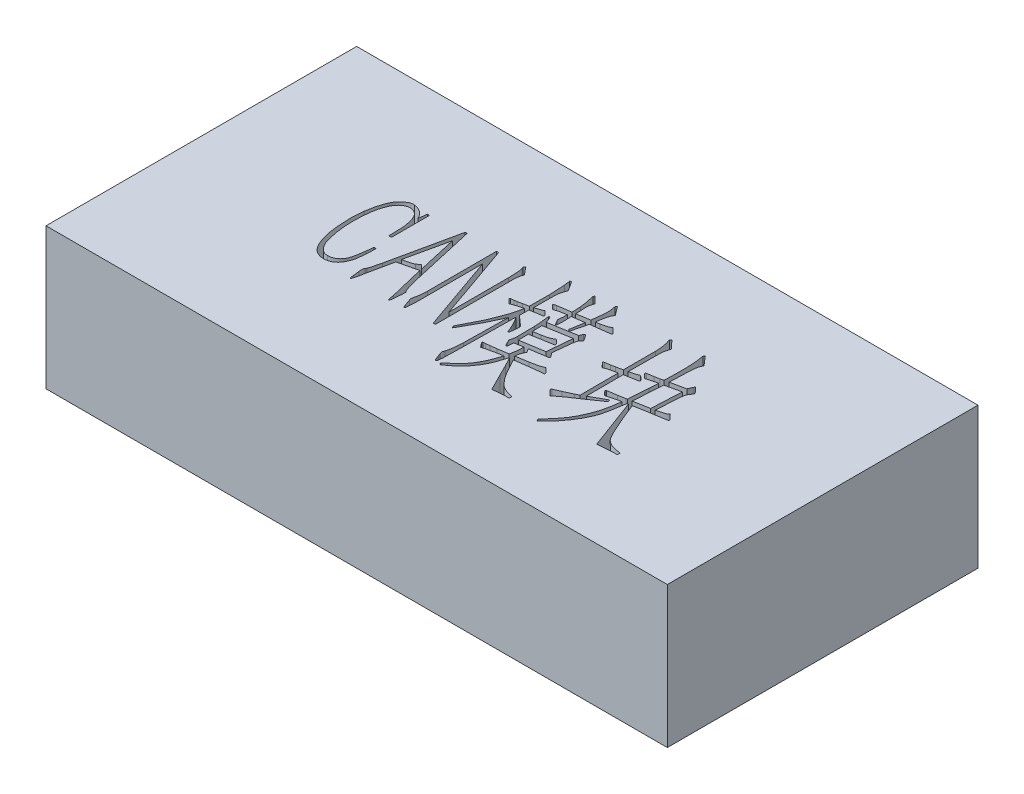
from build123d import *

# Parameters (mm, degrees)
SKETCH_1_W          = 22
SKETCH_1_H          = 11
EXTRUDE_1_DEPTH     = 5
CUT_EXTRUDE_1_DEPTH = 2


with BuildPart() as part:
    # 草图1 → 凸台-拉伸1 (new body)
    with BuildSketch(Plane(origin=(0, 0, 0), x_dir=(1, 0, 0), z_dir=(0, 1, 0))):
        Rectangle(SKETCH_1_W, SKETCH_1_H)
    extrude(amount=EXTRUDE_1_DEPTH)

    # 草图2 → 切除-拉伸1 (cut)
    # profile 1 of 8: a face of its own
    with BuildSketch(Plane(origin=(0, 5, 0), x_dir=(1, 0, 0), z_dir=(0, 1, 0))):
        with BuildLine():
            Line((-4.64088319, 1.310616693), (-4.605085193, 1.607441751))
            Line((-4.605085193, 1.607441751), (-4.529760241, 1.607441751))
            Line((-4.529760241, 1.607441751), (-4.529760241, 0.26352528))
            Line((-4.529760241, 0.26352528), (-4.625221566, 0.26352528))
            add(Edge.make_bspline(
                [(-4.625221566, 0.26352528), (-4.625352176, 0.287890137), (-4.625625439, 0.338866508), (-4.628541794, 0.420381785), (-4.630403387, 0.513374425), (-4.633571719, 0.618277741), (-4.636548971, 0.730597951), (-4.647539021, 0.845609071), (-4.664340131, 0.961845619), (-4.689979792, 1.078438421), (-4.723696551, 1.190871874), (-4.763534204, 1.27644821), (-4.800730949, 1.336535501), (-4.831200971, 1.375596691), (-4.865164463, 1.408878602), (-4.913767137, 1.445089925), (-4.980147624, 1.481572074), (-5.038889885, 1.491905022), (-5.068221779, 1.497064594)],
                knots=[0, 0, 0, 0, 0.822473136, 1.720785642, 2.753326599, 3.962261781, 5.264018637, 6.545024146, 7.860049611, 9.226346671, 10.572050264, 11.814683136, 12.399128484, 12.954850798, 13.483022901, 13.998303406, 15.000488703, 16, 16, 16, 16], degree=3))
            add(Edge.make_bspline(
                [(-5.068221779, 1.497064594), (-5.09064734, 1.497662838), (-5.135404141, 1.49885681), (-5.201946005, 1.485400853), (-5.266047028, 1.460286798), (-5.327546285, 1.42389627), (-5.386131353, 1.377130173), (-5.438090626, 1.317303176), (-5.4874979, 1.248621381), (-5.528474857, 1.168198102), (-5.564786533, 1.081764951), (-5.598564105, 0.99183706), (-5.62476189, 0.898110911), (-5.653099724, 0.770767415), (-5.678296215, 0.612791216), (-5.696399107, 0.428897936), (-5.705861374, 0.257175421), (-5.709191424, 0.096965535), (-5.705902254, -0.057002939), (-5.700437167, -0.158605462), (-5.697669893, -0.210052389)],
                knots=[0, 0, 0, 0, 0.603095173, 1.203653813, 1.814626149, 2.451293107, 3.123130818, 3.825388984, 4.580186105, 5.398460658, 6.251023789, 7.107448911, 7.985514538, 8.871470416, 10.622993602, 12.29317529, 13.850163291, 15.257553743, 16.61134915, 18, 18, 18, 18], degree=3))
            add(Edge.make_bspline(
                [(-5.697669893, -0.210052389), (-5.693646193, -0.256060744), (-5.685412829, -0.350203831), (-5.6717096, -0.469630663), (-5.655865374, -0.570725765), (-5.640155543, -0.654033399), (-5.620573195, -0.744255216), (-5.598601647, -0.837924557), (-5.57387269, -0.927538825), (-5.550653592, -1.007006365), (-5.527248928, -1.071905906), (-5.496453113, -1.138896515), (-5.452881369, -1.209201925), (-5.396278341, -1.284977893), (-5.332806056, -1.34767257), (-5.264757225, -1.395395436), (-5.18883468, -1.423134335), (-5.135817529, -1.426299087), (-5.108494526, -1.427930079)],
                knots=[0, 0, 0, 0, 1.515526627, 3.101096572, 3.943353373, 4.87293365, 5.882541642, 6.972773351, 8.029529644, 8.932786276, 9.68898916, 10.291221641, 11.348890653, 12.39638072, 13.388602443, 14.264213047, 15.105442077, 16, 16, 16, 16], degree=3))
            add(Edge.make_bspline(
                [(-5.108494526, -1.427930079), (-5.083031737, -1.428273572), (-5.031179152, -1.428973064), (-4.953948301, -1.409331756), (-4.878978017, -1.377956202), (-4.80895065, -1.331628839), (-4.747164525, -1.270124982), (-4.694617135, -1.19359554), (-4.652946882, -1.102448826), (-4.624152757, -0.99832507), (-4.600922084, -0.885987529), (-4.585821128, -0.790123386), (-4.575135352, -0.717668868), (-4.568221257, -0.674230019), (-4.563885509, -0.641856133), (-4.561341319, -0.624214003), (-4.560337697, -0.617254605)],
                knots=[0, 0, 0, 0, 0.974493461, 1.984464659, 3.032762083, 4.086915356, 5.187622472, 6.361151533, 7.634420725, 9.018373663, 10.501751059, 12.040324543, 12.745324753, 13.31527632, 13.729892907, 14, 14, 14, 14], degree=3))
            Line((-4.560337697, -0.617254605), (-4.534980782, -0.351007002))
            Line((-4.534980782, -0.351007002), (-4.454435289, -0.355481752))
            add(Edge.make_bspline(
                [(-4.454435289, -0.355481752), (-4.454334893, -0.380342441), (-4.454152168, -0.425590412), (-4.455262727, -0.487235193), (-4.455480292, -0.536231794), (-4.457478083, -0.576233602), (-4.458774778, -0.613809502), (-4.462039855, -0.655817693), (-4.466463653, -0.705793636), (-4.474431522, -0.779553017), (-4.482453234, -0.867955352), (-4.493678778, -0.966918593), (-4.510390695, -1.06361388), (-4.541749595, -1.164541573), (-4.584919978, -1.270493074), (-4.633681408, -1.355033718), (-4.680162645, -1.417582114), (-4.72084246, -1.459254445), (-4.765982353, -1.497273329), (-4.816291524, -1.529401076), (-4.86938156, -1.556413497), (-4.92469472, -1.575577703), (-4.980775236, -1.589972515), (-5.019161583, -1.592816829), (-5.038390115, -1.594241607)],
                knots=[0, 0, 0, 0, 1.082557886, 1.97032136, 2.684891572, 3.215786613, 3.714233695, 4.322010655, 5.050226996, 5.899051791, 7.552532718, 8.915438272, 10.236158893, 11.818471953, 13.507262255, 15.209909354, 16.052150521, 16.894322113, 17.739826851, 18.616631911, 19.488074199, 20.326969254, 21.161943562, 22, 22, 22, 22], degree=3))
            add(Edge.make_bspline(
                [(-5.038390115, -1.594241607), (-5.070554956, -1.595650565), (-5.136069877, -1.5985204), (-5.232714607, -1.576484069), (-5.323112626, -1.541568865), (-5.391944611, -1.501413288), (-5.441045015, -1.461581303), (-5.476056004, -1.424939523), (-5.51143879, -1.383199835), (-5.545317499, -1.334464722), (-5.579200792, -1.2799696), (-5.610766721, -1.218886753), (-5.64134625, -1.15208205), (-5.6822839, -1.053472378), (-5.72642208, -0.916929581), (-5.761630997, -0.771212133), (-5.785310664, -0.645196031), (-5.799563665, -0.542303896), (-5.813288107, -0.433461512), (-5.827816331, -0.281875359), (-5.839788932, -0.09340554), (-5.845909357, 0.129269821), (-5.839459768, 0.349907173), (-5.822100092, 0.496305055), (-5.813267592, 0.570791421)],
                knots=[0, 0, 0, 0, 0.828879423, 1.68830212, 2.536676829, 3.328986324, 3.73541648, 4.167069034, 4.63682846, 5.148487351, 5.699502401, 6.294435402, 6.924061178, 7.598240742, 9.053084533, 10.627089957, 11.470192478, 12.366164513, 13.311378798, 14.305576584, 16.301598498, 18.191207909, 20.062109376, 22, 22, 22, 22], degree=3))
            add(Edge.make_bspline(
                [(-5.813267592, 0.570791421), (-5.80318928, 0.645361694), (-5.783131982, 0.793767314), (-5.738376553, 0.973809487), (-5.695775042, 1.109293065), (-5.662673144, 1.199636964), (-5.627523804, 1.278239068), (-5.591488667, 1.346761189), (-5.552798896, 1.406440123), (-5.51212122, 1.460042103), (-5.466698773, 1.506091321), (-5.420472593, 1.54695334), (-5.374053898, 1.580297808), (-5.331391303, 1.607963118), (-5.293816024, 1.630313019), (-5.247160801, 1.649818792), (-5.185726889, 1.664836825), (-5.135190897, 1.663393034), (-5.108494526, 1.66263033)],
                knots=[0, 0, 0, 0, 2.546659555, 5.068220541, 6.268960188, 7.35572531, 8.324149365, 9.182807276, 9.974388089, 10.730435642, 11.456747585, 12.160764052, 12.817438768, 13.389505863, 13.883390408, 14.294592413, 15.099093679, 16, 16, 16, 16], degree=3))
            add(Edge.make_bspline(
                [(-5.108494526, 1.66263033), (-5.081195696, 1.657955707), (-5.025245096, 1.648374785), (-4.943426183, 1.618358543), (-4.862623703, 1.576915203), (-4.792683591, 1.518407564), (-4.730821085, 1.457958676), (-4.699931445, 1.412300315), (-4.685630686, 1.391162186)],
                knots=[0, 0, 0, 0, 0.959137923, 1.965811105, 3.01152559, 4.09188384, 5.116612916, 6, 6, 6, 6], degree=3))
            Line((-4.685630686, 1.391162186), (-4.64088319, 1.310616693))
        make_face()
    # profile 2 of 8: a face of its own
    with BuildSketch(Plane(origin=(0, 5, 0), x_dir=(1, 0, 0), z_dir=(0, 1, 0))):
        with BuildLine():
            Line((-3.012820117, -0.250325135), (-3.69745681, -0.415890872))
            Line((-3.69745681, -0.415890872), (-3.858547797, -1.166157226))
            Line((-3.858547797, -1.166157226), (-3.93461854, -1.548748319))
            Line((-3.93461854, -1.548748319), (-3.964450205, -1.669566559))
            add(Edge.make_bspline(
                [(-3.964450205, -1.669566559), (-3.967617933, -1.678124642), (-3.972960011, -1.69255705), (-3.983011742, -1.709536927), (-3.994042244, -1.717975047), (-4.006357923, -1.719753837), (-4.015597329, -1.709074642), (-4.021091501, -1.695540678), (-4.022736015, -1.675679395), (-4.027305697, -1.649820743), (-4.030163449, -1.612829118), (-4.033442582, -1.584777574), (-4.035300407, -1.568884692)],
                knots=[0, 0, 0, 0, 1.226577759, 2.068508672, 2.595953142, 3.064162245, 3.560072257, 4.322224954, 5.029865969, 6.20926766, 7.852322798, 10, 10, 10, 10], degree=3))
            Line((-4.035300407, -1.568884692), (-4.05991153, -1.357825668))
            add(Edge.make_bspline(
                [(-4.05991153, -1.357825668), (-4.061502368, -1.340433492), (-4.064340436, -1.309405719), (-4.066834096, -1.268354603), (-4.066996006, -1.238736671), (-4.065560792, -1.213958485), (-4.058223447, -1.190526359), (-4.04950673, -1.174467781), (-4.044995698, -1.166157226)],
                knots=[0, 0, 0, 0, 1.603576797, 2.86079302, 3.773774944, 4.323462854, 5.1323669, 6, 6, 6, 6], degree=3))
            Line((-4.044995698, -1.166157226), (-4.019638783, -1.120663938))
            add(Edge.make_bspline(
                [(-4.019638783, -1.120663938), (-4.014208014, -1.108815091), (-4.001238171, -1.080517501), (-3.984815897, -1.028423229), (-3.967319722, -0.960595675), (-3.94968981, -0.882527364), (-3.93240851, -0.806924943), (-3.918602835, -0.745323182), (-3.908006694, -0.704461353), (-3.901115312, -0.684357971), (-3.898820543, -0.677663725)],
                knots=[0, 0, 0, 0, 0.679694972, 1.623257572, 2.844174753, 4.335796169, 5.799225578, 6.891200865, 7.630779852, 8, 8, 8, 8], degree=3))
            Line((-3.898820543, -0.677663725), (-3.380495378, 1.72303945))
            Line((-3.380495378, 1.72303945), (-3.310390967, 1.72303945))
            Line((-3.310390967, 1.72303945), (-2.821897466, -0.436027245))
            Line((-2.821897466, -0.436027245), (-2.761488346, -0.688104807))
            add(Edge.make_bspline(
                [(-2.761488346, -0.688104807), (-2.755428749, -0.716481156), (-2.744558718, -0.767384169), (-2.72801762, -0.834985596), (-2.714451659, -0.885609177), (-2.704912545, -0.913366423), (-2.701079227, -0.924520746)],
                knots=[0, 0, 0, 0, 1.425899692, 2.557855139, 3.420470246, 4, 4, 4, 4], degree=3))
            Line((-2.701079227, -0.924520746), (-2.666027021, -1.019982071))
            add(Edge.make_bspline(
                [(-2.666027021, -1.019982071), (-2.661992255, -1.033965784), (-2.654641068, -1.059443568), (-2.642083726, -1.093163092), (-2.629742677, -1.119199179), (-2.614029465, -1.141126967), (-2.598090769, -1.157584597), (-2.587089035, -1.174651918), (-2.585699152, -1.19058476), (-2.587626217, -1.205191231), (-2.589684158, -1.223794305), (-2.590685502, -1.247218507), (-2.593343785, -1.279491719), (-2.594518059, -1.303874415), (-2.595176819, -1.317552921)],
                knots=[0, 0, 0, 0, 1.645080438, 2.997272953, 4.065812928, 4.892545225, 6.029861332, 6.67147811, 7.124734071, 7.80170629, 8.338742145, 9.240009017, 10.451666043, 12, 12, 12, 12], degree=3))
            Line((-2.595176819, -1.317552921), (-2.615313192, -1.543527778))
            Line((-2.615313192, -1.543527778), (-2.625754274, -1.629293812))
            add(Edge.make_bspline(
                [(-2.625754274, -1.629293812), (-2.626250698, -1.639020218), (-2.627133113, -1.656309334), (-2.63138714, -1.678579787), (-2.634172266, -1.694745403), (-2.640039875, -1.706440704), (-2.651187815, -1.712223664), (-2.665008131, -1.708190065), (-2.675630255, -1.694211167), (-2.678986139, -1.681941292), (-2.680942853, -1.6747871)],
                knots=[0, 0, 0, 0, 1.663187075, 2.956388731, 3.874273883, 4.464983498, 5.130530035, 5.83179128, 6.735783313, 8, 8, 8, 8], degree=3))
            Line((-2.680942853, -1.6747871), (-2.715995059, -1.473423367))
            Line((-2.715995059, -1.473423367), (-3.012820117, -0.250325135))
        make_face()
        with BuildLine():
            Line((-3.0232612, -0.174254392), (-3.345443173, 1.23976649))
            Line((-3.345443173, 1.23976649), (-3.672845687, -0.239884053))
            add(Edge.make_bspline(
                [(-3.672845687, -0.239884053), (-3.644443709, -0.235506257), (-3.595410409, -0.227948412), (-3.527068804, -0.212938639), (-3.462387965, -0.195171738), (-3.404950954, -0.179279335), (-3.357507121, -0.163156776), (-3.326508064, -0.152488665), (-3.30295788, -0.141465552), (-3.290431738, -0.133108195), (-3.285034053, -0.129506895)],
                knots=[0, 0, 0, 0, 1.70172219, 2.937860729, 4.141475294, 5.674569601, 6.46612829, 7.108957565, 7.616037637, 8, 8, 8, 8], degree=3))
            Line((-3.285034053, -0.129506895), (-3.158995272, -0.043740861))
            Line((-3.158995272, -0.043740861), (-3.0232612, -0.174254392))
        make_face(mode=Mode.SUBTRACT)
    # profile 3 of 8: a face of its own
    with BuildSketch(Plane(origin=(0, 5, 0), x_dir=(1, 0, 0), z_dir=(0, 1, 0))):
        with BuildLine():
            Line((-1.28482097, 1.682766704), (-1.239327682, 1.728259991))
            Line((-1.239327682, 1.728259991), (-1.023048116, 1.461266597))
            add(Edge.make_bspline(
                [(-1.023048116, 1.461266597), (-1.027760716, 1.445022691), (-1.036878347, 1.413595035), (-1.052035693, 1.375201179), (-1.061034161, 1.341909498), (-1.066974465, 1.311515544), (-1.071974654, 1.275151387), (-1.077496634, 1.222221601), (-1.081254252, 1.161257422), (-1.082794267, 1.114476224), (-1.083457236, 1.094337128)],
                knots=[0, 0, 0, 0, 1.084494799, 2.098210167, 2.643672211, 3.294173657, 4.083496456, 4.997481927, 6.707429351, 8, 8, 8, 8], degree=3))
            Line((-1.083457236, 1.094337128), (-1.083457236, -1.629293812))
            Line((-1.083457236, -1.629293812), (-1.158782188, -1.629293812))
            Line((-1.158782188, -1.629293812), (-2.105191735, 1.068980213))
            Line((-2.105191735, 1.068980213), (-2.105191735, -1.221345804))
            add(Edge.make_bspline(
                [(-2.105191735, -1.221345804), (-2.105424802, -1.240238486), (-2.105921653, -1.280513657), (-2.107054979, -1.344947176), (-2.111347047, -1.416722406), (-2.11546401, -1.491701678), (-2.119519281, -1.559494285), (-2.126090271, -1.613045208), (-2.129906892, -1.643731232), (-2.140034901, -1.666277462), (-2.160767875, -1.657618606), (-2.177090932, -1.639527), (-2.195189494, -1.60472476), (-2.205151639, -1.576202919), (-2.211094142, -1.559189401)],
                knots=[0, 0, 0, 0, 1.182286761, 2.52038347, 4.031227312, 5.682702803, 7.210982332, 8.306924227, 8.990285397, 9.270708198, 9.606495757, 10.101576878, 10.867574663, 12, 12, 12, 12], degree=3))
            Line((-2.211094142, -1.559189401), (-2.291639636, -1.332468754))
            add(Edge.make_bspline(
                [(-2.291639636, -1.332468754), (-2.296906924, -1.318008911), (-2.305768506, -1.293681958), (-2.311750945, -1.256897887), (-2.302453359, -1.221238981), (-2.292877156, -1.186888054), (-2.283417574, -1.150363593), (-2.275227459, -1.113859439), (-2.267137386, -1.069806368), (-2.259188973, -1.018306138), (-2.250179887, -0.959560511), (-2.246000533, -0.893481081), (-2.241547761, -0.820665376), (-2.241629009, -0.769902675), (-2.241671598, -0.743293386)],
                knots=[0, 0, 0, 0, 0.927779361, 1.560877733, 2.200839638, 3.115853294, 3.718492711, 4.470182357, 5.368516448, 6.414355644, 7.608241643, 8.944514625, 10.398345751, 12, 12, 12, 12], degree=3))
            Line((-2.241671598, -0.743293386), (-2.241671598, 1.693207786))
            Line((-2.241671598, 1.693207786), (-2.165600854, 1.693207786))
            Line((-2.165600854, 1.693207786), (-1.219191308, -1.015507322))
            Line((-1.219191308, -1.015507322), (-1.219191308, 1.089116586))
            add(Edge.make_bspline(
                [(-1.219191308, 1.089116586), (-1.219639022, 1.130392363), (-1.220521429, 1.211743517), (-1.225864843, 1.311410132), (-1.230861001, 1.38571225), (-1.234522203, 1.43320158), (-1.238126487, 1.472753177), (-1.243143337, 1.514583696), (-1.249977744, 1.560809283), (-1.259842755, 1.595591063), (-1.264684596, 1.612662293)],
                knots=[0, 0, 0, 0, 1.880234277, 3.705786779, 4.545737466, 5.272737238, 5.875620033, 6.354622927, 7.192433219, 8, 8, 8, 8], degree=3))
            Line((-1.264684596, 1.612662293), (-1.28482097, 1.682766704))
        make_face()
    # profile 4 of 8: a face of its own
    with BuildSketch(Plane(origin=(0, 5, 0), x_dir=(1, 0, 0), z_dir=(0, 1, 0))):
        with BuildLine():
            Line((0.197066949, -2.706962681), (0.317885189, -2.606280814))
            add(Edge.make_bspline(
                [(0.317885189, -2.606280814), (0.345136426, -2.583840327), (0.398350779, -2.540020076), (0.473425618, -2.473044164), (0.542628067, -2.406933353), (0.605994323, -2.341864165), (0.662681652, -2.276434296), (0.714425517, -2.212792941), (0.75938186, -2.149165213), (0.80960657, -2.066983111), (0.863694144, -1.969137831), (0.920821255, -1.858895656), (0.96750015, -1.757906076), (1.004170042, -1.665795632), (1.032893142, -1.582489615), (1.057712943, -1.50847558), (1.078380952, -1.443027128), (1.088716794, -1.401628882), (1.093508457, -1.382436791)],
                knots=[0, 0, 0, 0, 1.146874943, 2.239539032, 3.267825151, 4.256026981, 5.189084782, 6.079643312, 6.919999131, 7.717946355, 9.207728609, 10.551521386, 11.751409045, 12.820809137, 13.771082776, 14.613957827, 15.357435383, 16, 16, 16, 16], degree=3))
            Line((1.093508457, -1.382436791), (0.821294522, -1.43315062))
            Line((0.821294522, -1.43315062), (0.614710247, -1.478643908))
            Line((0.614710247, -1.478643908), (0.56474221, -1.488339199))
            Line((0.56474221, -1.488339199), (0.499112548, -1.508475572))
            Line((0.499112548, -1.508475572), (0.423787596, -1.533832487))
            add(Edge.make_bspline(
                [(0.423787596, -1.533832487), (0.420207083, -1.530944438), (0.408042997, -1.521132864), (0.399346684, -1.508027832), (0.393210141, -1.498780281)],
                knots=[0, 0, 0, 0, 0.588702377, 2, 2, 2, 2], degree=3))
            Line((0.393210141, -1.498780281), (0.297748815, -1.377962041))
            add(Edge.make_bspline(
                [(0.297748815, -1.377962041), (0.295083833, -1.375675165), (0.28904556, -1.370493597), (0.289916764, -1.357367843), (0.293179465, -1.344992651), (0.299922088, -1.339962587), (0.302969356, -1.337689295)],
                knots=[0, 0, 0, 0, 0.849119331, 1.923921266, 3.061734868, 4, 4, 4, 4], degree=3))
            Line((0.302969356, -1.337689295), (0.393210141, -1.327248212))
            Line((0.393210141, -1.327248212), (0.539385295, -1.31233238))
            Line((0.539385295, -1.31233238), (0.751190111, -1.286975466))
            Line((0.751190111, -1.286975466), (1.128560663, -1.226566346))
            add(Edge.make_bspline(
                [(1.128560663, -1.226566346), (1.135126948, -1.199292615), (1.148305797, -1.144552933), (1.161300751, -1.063655648), (1.171200107, -0.991223132), (1.178170394, -0.933070608), (1.181960883, -0.892020238), (1.181448967, -0.865530492), (1.178730622, -0.845516332), (1.177600358, -0.82284893), (1.176247933, -0.791264295), (1.174838656, -0.76715749), (1.174053951, -0.753734468)],
                knots=[0, 0, 0, 0, 1.761607771, 3.535631099, 5.143435654, 6.354082732, 7.215252018, 7.73082906, 8.013653701, 8.483184989, 9.155415208, 10, 10, 10, 10], degree=3))
            Line((1.174053951, -0.753734468), (0.872008351, -0.808923047))
            Line((0.872008351, -0.808923047), (0.866787809, -0.899163831))
            Line((0.866787809, -0.899163831), (0.861567268, -0.979709325))
            add(Edge.make_bspline(
                [(0.861567268, -0.979709325), (0.859526586, -0.988218848), (0.855869605, -1.003468236), (0.848655622, -1.022566399), (0.841712219, -1.035762731), (0.832052569, -1.043045035), (0.820512927, -1.040597924), (0.810727736, -1.030949116), (0.801366655, -1.015196768), (0.79508983, -1.002631567), (0.791462857, -0.995370948)],
                knots=[0, 0, 0, 0, 1.549214281, 2.77625084, 3.607347699, 4.181663947, 4.761025529, 5.511136713, 6.561846494, 8, 8, 8, 8], degree=3))
            Line((0.791462857, -0.995370948), (0.751190111, -0.919300205))
            Line((0.751190111, -0.919300205), (0.715392114, -0.849195794))
            add(Edge.make_bspline(
                [(0.715392114, -0.849195794), (0.710151327, -0.839544264), (0.701660839, -0.823908025), (0.695408257, -0.79851043), (0.704444876, -0.773153799), (0.714674619, -0.739270733), (0.726251226, -0.691033634), (0.733458652, -0.632813747), (0.739774577, -0.574867196), (0.740456694, -0.537715406), (0.740749028, -0.521793279)],
                knots=[0, 0, 0, 0, 0.787865145, 1.276403611, 1.807175721, 2.662650098, 3.832163557, 5.341824222, 6.860786771, 8, 8, 8, 8], degree=3))
            Line((0.740749028, -0.521793279), (0.731053737, 0.056941006))
            add(Edge.make_bspline(
                [(0.731053737, 0.056941006), (0.730316345, 0.071857032), (0.728718333, 0.10418173), (0.725957487, 0.15617345), (0.721060343, 0.215044564), (0.716370096, 0.28101564), (0.708269431, 0.353751074), (0.70049196, 0.433620112), (0.690452882, 0.520069246), (0.683793785, 0.579986742), (0.680339908, 0.611064168)],
                knots=[0, 0, 0, 0, 0.643997864, 1.395615433, 2.244927022, 3.191258582, 4.247264567, 5.400339857, 6.651633509, 8, 8, 8, 8], degree=3))
            Line((0.680339908, 0.611064168), (0.720612655, 0.635675291))
            Line((0.720612655, 0.635675291), (0.821294522, 0.399259352))
            Line((0.821294522, 0.399259352), (1.793060982, 0.56557088))
            Line((1.793060982, 0.56557088), (1.848249561, 0.681168579))
            add(Edge.make_bspline(
                [(1.848249561, 0.681168579), (1.852704596, 0.689915998), (1.860128026, 0.704491834), (1.878603374, 0.720715002), (1.900675983, 0.714312625), (1.908950249, 0.702889285), (1.913879222, 0.696084411)],
                knots=[0, 0, 0, 0, 1.30604772, 2.176269012, 2.91360508, 4, 4, 4, 4], degree=3))
            Line((1.913879222, 0.696084411), (2.01978163, 0.540213965))
            add(Edge.make_bspline(
                [(2.01978163, 0.540213965), (2.025091378, 0.530506326), (2.033827867, 0.514533686), (2.041561901, 0.49144445), (2.037386787, 0.47222924), (2.026438823, 0.454225363), (2.006663732, 0.43347182), (1.980011533, 0.408192605), (1.950895307, 0.374147526), (1.933785649, 0.324751656), (1.922628254, 0.262155617), (1.917061681, 0.215101551), (1.913879222, 0.188200328)],
                knots=[0, 0, 0, 0, 0.850722409, 1.399751525, 1.806411074, 2.308985733, 2.99617779, 3.991559364, 5.129430401, 6.3763991, 7.928355556, 10, 10, 10, 10], degree=3))
            Line((1.913879222, 0.188200328), (1.848249561, -0.446468327))
            Line((1.848249561, -0.446468327), (1.943710886, -0.562066026))
            add(Edge.make_bspline(
                [(1.943710886, -0.562066026), (1.950843707, -0.572091774), (1.962715712, -0.588778821), (1.96547574, -0.614305607), (1.960578158, -0.632253114), (1.952211707, -0.635943909), (1.948931428, -0.637390978)],
                knots=[0, 0, 0, 0, 1.668816277, 2.777610002, 3.520731095, 4, 4, 4, 4], degree=3))
            Line((1.948931428, -0.637390978), (1.913879222, -0.642611519))
            Line((1.913879222, -0.642611519), (1.309788023, -0.733598095))
            Line((1.309788023, -0.733598095), (1.390333516, -0.864111626))
            add(Edge.make_bspline(
                [(1.390333516, -0.864111626), (1.373801394, -0.897238236), (1.343015646, -0.95892587), (1.323871975, -1.025128586), (1.315008564, -1.055780068)],
                knots=[0, 0, 0, 0, 1.074011353, 2, 2, 2, 2], degree=3))
            Line((1.315008564, -1.055780068), (1.29934694, -1.136325562))
            Line((1.29934694, -1.136325562), (1.289651649, -1.196734682))
            Line((1.289651649, -1.196734682), (1.727431321, -1.125884479))
            add(Edge.make_bspline(
                [(1.727431321, -1.125884479), (1.777016578, -1.117503591), (1.869956521, -1.101794904), (1.998809918, -1.071311992), (2.108074224, -1.037724657), (2.17190455, -1.008634886), (2.20100899, -0.995370948)],
                knots=[0, 0, 0, 0, 1.223824394, 2.29387076, 3.222063562, 4, 4, 4, 4], degree=3))
            Line((2.20100899, -0.995370948), (2.356879435, -1.156461935))
            add(Edge.make_bspline(
                [(2.356879435, -1.156461935), (2.362434992, -1.163892632), (2.372009982, -1.176699424), (2.374812475, -1.196514758), (2.372895849, -1.212769307), (2.365192509, -1.215696089), (2.362099977, -1.216871055)],
                knots=[0, 0, 0, 0, 1.549236882, 2.670106629, 3.466109828, 4, 4, 4, 4], degree=3))
            Line((2.362099977, -1.216871055), (2.175652075, -1.237007428))
            Line((2.175652075, -1.237007428), (1.948931428, -1.261618551))
            Line((1.948931428, -1.261618551), (1.385112975, -1.337689295))
            add(Edge.make_bspline(
                [(1.385112975, -1.337689295), (1.404876181, -1.376039003), (1.442981263, -1.449980385), (1.50006322, -1.555789671), (1.55246188, -1.653297655), (1.601973982, -1.741394798), (1.647162722, -1.820787535), (1.690022323, -1.890796108), (1.728226995, -1.952580218), (1.774341191, -2.021377805), (1.830586346, -2.096227632), (1.896993206, -2.177859613), (1.964819956, -2.249084519), (2.022160575, -2.302731921), (2.071875154, -2.340775599), (2.114738988, -2.366709561), (2.163217731, -2.391119809), (2.217078937, -2.414083652), (2.276362844, -2.436192491), (2.341993177, -2.454697892), (2.412699194, -2.473772702), (2.461982547, -2.484438207), (2.487392966, -2.489937324)],
                knots=[0, 0, 0, 0, 1.551008152, 2.990470873, 4.322186468, 5.530566477, 6.623610574, 7.60612461, 8.481496625, 9.235059845, 10.582843594, 11.846194645, 13.015776781, 14.116576289, 14.665340918, 15.263151263, 15.914668952, 16.615279029, 17.367409871, 18.18751869, 19.06548751, 20, 20, 20, 20], degree=3))
            Line((2.487392966, -2.489937324), (2.487392966, -2.5809239))
            Line((2.487392966, -2.5809239), (2.215924822, -2.595839732))
            Line((2.215924822, -2.595839732), (2.060054377, -2.606280814))
            Line((2.060054377, -2.606280814), (1.908658681, -2.626417187))
            Line((1.908658681, -2.626417187), (1.606613081, -2.026800737))
            Line((1.606613081, -2.026800737), (1.425385721, -1.659871268))
            Line((1.425385721, -1.659871268), (1.264294735, -1.352605127))
            Line((1.264294735, -1.352605127), (1.244158361, -1.352605127))
            add(Edge.make_bspline(
                [(1.244158361, -1.352605127), (1.231627383, -1.395406962), (1.20758747, -1.477519657), (1.170596318, -1.595168185), (1.132406297, -1.701739466), (1.093970277, -1.800365874), (1.051016459, -1.894907152), (1.00091298, -1.989496777), (0.942595031, -2.086549308), (0.877399104, -2.183081071), (0.811243391, -2.275273288), (0.74597624, -2.356903591), (0.685308811, -2.426643561), (0.625328823, -2.486071473), (0.561310301, -2.540065025), (0.491631197, -2.597877315), (0.410725496, -2.658576025), (0.353253586, -2.700097648), (0.32310573, -2.721878513)],
                knots=[0, 0, 0, 0, 1.2659944, 2.428732615, 3.50010511, 4.478986637, 5.432693408, 6.445970666, 7.515808209, 8.64510948, 9.75176074, 10.735918748, 11.610870976, 12.374338797, 13.129807163, 13.987282729, 14.944195334, 16, 16, 16, 16], degree=3))
            Line((0.32310573, -2.721878513), (0.222423863, -2.791982924))
            Line((0.222423863, -2.791982924), (0.197066949, -2.706962681))
        make_face()
        with BuildLine():
            Line((0.851871977, -0.129506895), (1.113644831, -0.084013608))
            add(Edge.make_bspline(
                [(1.113644831, -0.084013608), (1.154320345, -0.076765115), (1.232196592, -0.062887345), (1.341341586, -0.031871663), (1.437427756, 0.00724455), (1.493849239, 0.040857251), (1.520847047, 0.056941006)],
                knots=[0, 0, 0, 0, 1.141821217, 2.186100232, 3.132044836, 4, 4, 4, 4], degree=3))
            Line((1.520847047, 0.056941006), (1.652106369, -0.084013608))
            add(Edge.make_bspline(
                [(1.652106369, -0.084013608), (1.657635131, -0.090387382), (1.6677347, -0.102030562), (1.67048695, -0.122341765), (1.666561412, -0.140593258), (1.656604853, -0.143230977), (1.652106369, -0.144422728)],
                knots=[0, 0, 0, 0, 1.334434594, 2.437654729, 3.294114984, 4, 4, 4, 4], degree=3))
            Line((1.652106369, -0.144422728), (1.611833622, -0.154118018))
            Line((1.611833622, -0.154118018), (0.861567268, -0.285377341))
            Line((0.861567268, -0.285377341), (0.866787809, -0.642611519))
            Line((0.866787809, -0.642611519), (1.712515489, -0.506877447))
            Line((1.712515489, -0.506877447), (1.793060982, 0.379122979))
            Line((1.793060982, 0.379122979), (0.841430895, 0.218031992))
            Line((0.841430895, 0.218031992), (0.851871977, -0.129506895))
        make_face(mode=Mode.SUBTRACT)
    # profile 5 of 8: a face of its own
    with BuildSketch(Plane(origin=(0, 5, 0), x_dir=(1, 0, 0), z_dir=(0, 1, 0))):
        with BuildLine():
            Line((0.962249135, 1.164441538), (0.947333303, 1.476928221))
            add(Edge.make_bspline(
                [(0.947333303, 1.476928221), (0.946034373, 1.484626619), (0.942816474, 1.503698228), (0.938866538, 1.538399236), (0.931810765, 1.584058095), (0.924031056, 1.637993537), (0.916563928, 1.693002107), (0.909241209, 1.742791466), (0.901855127, 1.783549792), (0.894311745, 1.819036633), (0.886231096, 1.85561098), (0.875681444, 1.899590614), (0.86225121, 1.954032878), (0.852148497, 1.993768773), (0.846651436, 2.015389759)],
                knots=[0, 0, 0, 0, 0.512494815, 1.269627774, 2.292145508, 3.545478819, 4.847289561, 5.936780467, 6.84916104, 7.566178404, 8.318546699, 9.308233625, 10.535363449, 12, 12, 12, 12], degree=3))
            Line((0.846651436, 2.015389759), (0.8764831, 2.060883047))
            Line((0.8764831, 2.060883047), (1.113644831, 1.834162399))
            add(Edge.make_bspline(
                [(1.113644831, 1.834162399), (1.103185254, 1.801250097), (1.083715366, 1.73998578), (1.063419369, 1.649598685), (1.056109682, 1.560967153), (1.060595344, 1.502270613), (1.062931001, 1.471707679)],
                knots=[0, 0, 0, 0, 1.122233601, 2.088971886, 3.004939198, 4, 4, 4, 4], degree=3))
            Line((1.062931001, 1.471707679), (1.077846834, 1.17935737))
            Line((1.077846834, 1.17935737), (1.53650867, 1.255428114))
            add(Edge.make_bspline(
                [(1.53650867, 1.255428114), (1.540222454, 1.282278445), (1.547202087, 1.332740582), (1.55722094, 1.403517603), (1.564451516, 1.464735064), (1.572692582, 1.533763008), (1.580109364, 1.614562331), (1.586932663, 1.709026896), (1.590404276, 1.799084088), (1.58840664, 1.871137606), (1.58169818, 1.928931713), (1.575458334, 1.979313026), (1.564459532, 2.037637776), (1.555961994, 2.079045183), (1.551424502, 2.101155794)],
                knots=[0, 0, 0, 0, 1.145773838, 2.1533514, 3.021403411, 3.751322794, 5.091801904, 6.45064824, 7.754336532, 8.900495796, 9.492320142, 10.21310566, 11.045839205, 12, 12, 12, 12], degree=3))
            Line((1.551424502, 2.101155794), (1.591697249, 2.14590329))
            Line((1.591697249, 2.14590329), (1.828113188, 1.828941858))
            add(Edge.make_bspline(
                [(1.828113188, 1.828941858), (1.817567201, 1.812739511), (1.796580567, 1.780496656), (1.771305184, 1.728281539), (1.750397191, 1.673874995), (1.733579881, 1.614908807), (1.719377697, 1.547539753), (1.705411947, 1.467914766), (1.691521341, 1.37384622), (1.682360627, 1.306400578), (1.677463284, 1.270343946)],
                knots=[0, 0, 0, 0, 0.793397039, 1.578869155, 2.377244627, 3.185162385, 4.094482046, 5.204180386, 6.505346915, 8, 8, 8, 8], degree=3))
            Line((1.677463284, 1.270343946), (1.818417897, 1.295700861))
            add(Edge.make_bspline(
                [(1.818417897, 1.295700861), (1.851359402, 1.301862322), (1.915097519, 1.31378406), (2.005422107, 1.340028882), (2.087364756, 1.371517744), (2.136865787, 1.39835639), (2.160736243, 1.411298559)],
                knots=[0, 0, 0, 0, 1.106644328, 2.141232678, 3.103662624, 4, 4, 4, 4], degree=3))
            Line((2.160736243, 1.411298559), (2.331522521, 1.250207573))
            add(Edge.make_bspline(
                [(2.331522521, 1.250207573), (2.337061673, 1.242780894), (2.346759029, 1.229779059), (2.349566613, 1.209868471), (2.347305818, 1.193792341), (2.339836822, 1.190968236), (2.336743062, 1.189798453)],
                knots=[0, 0, 0, 0, 1.548786506, 2.711449808, 3.466265035, 4, 4, 4, 4], degree=3))
            Line((2.336743062, 1.189798453), (2.306165606, 1.184577912))
            Line((2.306165606, 1.184577912), (1.641665287, 1.098811877))
            Line((1.641665287, 1.098811877), (1.500710673, 0.530518675))
            Line((1.500710673, 0.530518675), (1.430606262, 0.560350339))
            Line((1.430606262, 0.560350339), (1.516372297, 1.078675504))
            Line((1.516372297, 1.078675504), (1.083067375, 1.018266384))
            Line((1.083067375, 1.018266384), (1.093508457, 0.666252747))
            add(Edge.make_bspline(
                [(1.093508457, 0.666252747), (1.09295818, 0.644184044), (1.091760531, 0.596152714), (1.082570408, 0.536384744), (1.077443671, 0.496726579), (1.06204018, 0.473952564), (1.04012336, 0.491423098), (1.032754856, 0.505525125), (1.027878796, 0.514857051)],
                knots=[0, 0, 0, 0, 1.636041157, 3.560754536, 4.35805444, 4.760807244, 5.179972132, 6, 6, 6, 6], degree=3))
            Line((1.027878796, 0.514857051), (0.982385508, 0.590927795))
            Line((0.982385508, 0.590927795), (0.952553844, 0.651336914))
            add(Edge.make_bspline(
                [(0.952553844, 0.651336914), (0.949165496, 0.660712714), (0.944273534, 0.67424912), (0.932598948, 0.691162691), (0.936629674, 0.713595953), (0.94225448, 0.740797103), (0.948714102, 0.782003579), (0.953426759, 0.836683764), (0.957382582, 0.9128664), (0.960497858, 0.970788952), (0.962249135, 1.003350552)],
                knots=[0, 0, 0, 0, 0.672812421, 0.971379767, 1.322275796, 2.120978324, 2.881080007, 4.105069577, 5.810435449, 8, 8, 8, 8], degree=3))
            add(Edge.make_bspline(
                [(0.962249135, 1.003350552), (0.924371023, 0.99815227), (0.849958508, 0.987940114), (0.741900582, 0.964037241), (0.63830225, 0.937105319), (0.572065289, 0.914045794), (0.539385295, 0.902668685)],
                knots=[0, 0, 0, 0, 1.052908673, 2.068465868, 3.047019636, 4, 4, 4, 4], degree=3))
            Line((0.539385295, 0.902668685), (0.398430682, 1.033928008))
            add(Edge.make_bspline(
                [(0.398430682, 1.033928008), (0.394383961, 1.038344253), (0.387214276, 1.046168635), (0.381512458, 1.060795989), (0.38874924, 1.074685653), (0.398159817, 1.077205237), (0.403651223, 1.078675504)],
                knots=[0, 0, 0, 0, 1.203255092, 2.131839985, 2.909862101, 4, 4, 4, 4], degree=3))
            Line((0.403651223, 1.078675504), (0.484196716, 1.094337128))
            Line((0.484196716, 1.094337128), (0.962249135, 1.164441538))
        make_face()
    # profile 6 of 8: a face of its own
    with BuildSketch(Plane(origin=(0, 5, 0), x_dir=(1, 0, 0), z_dir=(0, 1, 0))):
        with BuildLine():
            Line((-0.718765142, -1.362300418), (-0.613608525, -1.156461935))
            add(Edge.make_bspline(
                [(-0.613608525, -1.156461935), (-0.588890974, -1.110279349), (-0.54224211, -1.023120019), (-0.477895096, -0.899035563), (-0.423091797, -0.78970337), (-0.374144044, -0.691465888), (-0.329728244, -0.594783833), (-0.285807115, -0.490689588), (-0.240011856, -0.375396734), (-0.20067709, -0.273978169), (-0.170616962, -0.191901488), (-0.14971928, -0.13522699), (-0.131115388, -0.084838072), (-0.115257413, -0.040900715), (-0.102903844, -0.003075262), (-0.091350067, 0.02794503), (-0.083103511, 0.053064214), (-0.077339744, 0.074330583), (-0.071294359, 0.096123905), (-0.065109199, 0.123418681), (-0.05572968, 0.157800373), (-0.045267915, 0.199507169), (-0.034366324, 0.24916136), (-0.021072728, 0.306123759), (-0.00492093, 0.370275411), (0.005258316, 0.415641039), (0.010619047, 0.439532099)],
                knots=[0, 0, 0, 0, 2.192090015, 4.137080975, 5.849247459, 7.310196362, 8.730004666, 10.30097521, 12.037745032, 13.921505976, 14.853015959, 15.695639311, 16.449376351, 17.100907773, 17.650329499, 18.114309181, 18.486081474, 18.756173349, 19.036297513, 19.432452906, 19.927032042, 20.527561157, 21.231705536, 22.054375774, 22.975369124, 24, 24, 24, 24], degree=3))
            Line((0.010619047, 0.439532099), (-0.180303603, 0.389564061))
            Line((-0.180303603, 0.389564061), (-0.271290179, 0.358986605))
            Line((-0.271290179, 0.358986605), (-0.346615131, 0.333629691))
            Line((-0.346615131, 0.333629691), (-0.412244792, 0.309018568))
            add(Edge.make_bspline(
                [(-0.412244792, 0.309018568), (-0.417367414, 0.311811606), (-0.433207019, 0.32044793), (-0.444724726, 0.334537711), (-0.452517539, 0.344070773)],
                knots=[0, 0, 0, 0, 0.64681182, 2, 2, 2, 2], degree=3))
            Line((-0.452517539, 0.344070773), (-0.553199406, 0.449973181))
            add(Edge.make_bspline(
                [(-0.553199406, 0.449973181), (-0.557221142, 0.453055502), (-0.564549568, 0.458672122), (-0.567397273, 0.472768621), (-0.560565899, 0.484989829), (-0.552280581, 0.488449615), (-0.547978864, 0.490245928)],
                knots=[0, 0, 0, 0, 1.108637909, 2.020165101, 2.972074495, 4, 4, 4, 4], degree=3))
            Line((-0.547978864, 0.490245928), (-0.436855915, 0.50516176))
            Line((-0.436855915, 0.50516176), (-0.346615131, 0.514857051))
            Line((-0.346615131, 0.514857051), (-0.185524144, 0.550655048))
            Line((-0.185524144, 0.550655048), (0.02106013, 0.590927795))
            Line((0.02106013, 0.590927795), (0.026280671, 1.295700861))
            add(Edge.make_bspline(
                [(0.026280671, 1.295700861), (0.026076711, 1.31086616), (0.025578383, 1.347919038), (0.023269404, 1.413817786), (0.018263544, 1.500032235), (0.014547452, 1.582840358), (0.010861666, 1.653197634), (0.007580054, 1.702388632), (0.005642495, 1.745427278), (0.00330844, 1.782214333), (0.001266992, 1.812812234), (-0.001273124, 1.837125974), (-0.00242873, 1.855332222), (-0.003762073, 1.865240916), (-0.004296785, 1.869214605)],
                knots=[0, 0, 0, 0, 0.950484007, 2.322286289, 4.131937157, 6.362489266, 7.517063585, 8.547204664, 9.452030098, 10.216860513, 10.857332267, 11.373579574, 11.74878631, 12, 12, 12, 12], degree=3))
            Line((-0.004296785, 1.869214605), (-0.029653699, 2.070578338))
            Line((-0.029653699, 2.070578338), (0.010619047, 2.105630543))
            Line((0.010619047, 2.105630543), (0.237339695, 1.753616906))
            add(Edge.make_bspline(
                [(0.237339695, 1.753616906), (0.228645566, 1.73107977), (0.212140023, 1.688293697), (0.192289946, 1.62583542), (0.175394235, 1.569627749), (0.163351296, 1.51584215), (0.155782583, 1.458956989), (0.151120104, 1.39321164), (0.14697458, 1.315638236), (0.147055555, 1.25991006), (0.147098911, 1.2300712)],
                knots=[0, 0, 0, 0, 1.081974454, 2.054095877, 2.935321662, 3.710900805, 4.520521189, 5.503744956, 6.663415702, 8, 8, 8, 8], degree=3))
            Line((0.147098911, 1.2300712), (0.14187837, 0.620759459))
            add(Edge.make_bspline(
                [(0.14187837, 0.620759459), (0.163027949, 0.627412783), (0.202925269, 0.639963852), (0.258890153, 0.658543625), (0.307278024, 0.675725377), (0.348447898, 0.690888541), (0.382818319, 0.703048677), (0.409468536, 0.714464805), (0.429496291, 0.722997185), (0.439744317, 0.729308387), (0.44392397, 0.731882408)],
                knots=[0, 0, 0, 0, 1.651140455, 3.114770222, 4.391270206, 5.474751738, 6.382674209, 7.104705189, 7.634854439, 8, 8, 8, 8], degree=3))
            Line((0.44392397, 0.731882408), (0.574437501, 0.585707253))
            add(Edge.make_bspline(
                [(0.574437501, 0.585707253), (0.577275831, 0.57961181), (0.582580339, 0.568220139), (0.581227642, 0.550986283), (0.573387233, 0.536963976), (0.564116924, 0.535646495), (0.559521668, 0.534993424)],
                knots=[0, 0, 0, 0, 1.244450851, 2.325732925, 3.170072371, 4, 4, 4, 4], degree=3))
            Line((0.559521668, 0.534993424), (0.378294309, 0.510382301))
            Line((0.378294309, 0.510382301), (0.131437287, 0.464889013))
            Line((0.131437287, 0.464889013), (0.126962538, 0.137486499))
            Line((0.126962538, 0.137486499), (0.373073767, -0.084013608))
            Line((0.373073767, -0.084013608), (0.469280884, -0.164559101))
            add(Edge.make_bspline(
                [(0.469280884, -0.164559101), (0.474925721, -0.170429168), (0.484680134, -0.180572783), (0.492219965, -0.19733176), (0.492435807, -0.213306321), (0.492670758, -0.232185113), (0.490530294, -0.258767399), (0.489817188, -0.279160722), (0.489417258, -0.290597882)],
                knots=[0, 0, 0, 0, 1.097149937, 1.895901285, 2.401075994, 3.241169038, 4.452768457, 6, 6, 6, 6], degree=3))
            Line((0.489417258, -0.290597882), (0.469280884, -0.506877447))
            add(Edge.make_bspline(
                [(0.469280884, -0.506877447), (0.467997339, -0.516370984), (0.465750847, -0.53298681), (0.460262196, -0.55435009), (0.45539941, -0.569825302), (0.447628472, -0.578766384), (0.437293483, -0.581312463), (0.427989723, -0.572561556), (0.417698502, -0.560312856), (0.412086416, -0.54862472), (0.408871764, -0.541929653)],
                knots=[0, 0, 0, 0, 1.717560901, 3.006118357, 3.967819822, 4.599207767, 5.054508088, 5.698399978, 6.681623267, 8, 8, 8, 8], degree=3))
            Line((0.408871764, -0.541929653), (0.388735391, -0.486741074))
            Line((0.388735391, -0.486741074), (0.328326271, -0.34056592))
            Line((0.328326271, -0.34056592), (0.288053524, -0.260020426))
            Line((0.288053524, -0.260020426), (0.232119154, -0.15933856))
            Line((0.232119154, -0.15933856), (0.191846407, -0.084013608))
            Line((0.191846407, -0.084013608), (0.121741997, 0.0218888))
            Line((0.121741997, 0.0218888), (0.091164541, -2.087209857))
            Line((0.091164541, -2.087209857), (0.08146925, -2.429528204))
            Line((0.08146925, -2.429528204), (0.08146925, -2.510073697))
            Line((0.08146925, -2.510073697), (0.071028167, -2.595839732))
            Line((0.071028167, -2.595839732), (0.066553418, -2.661469393))
            add(Edge.make_bspline(
                [(0.066553418, -2.661469393), (0.064874413, -2.671228855), (0.061887356, -2.688591559), (0.054100476, -2.710596885), (0.044230828, -2.725554935), (0.031441129, -2.734065052), (0.015826979, -2.730899287), (0.004248078, -2.716170004), (-0.008612954, -2.695141133), (-0.015341326, -2.677081101), (-0.019212617, -2.666689934)],
                knots=[0, 0, 0, 0, 1.394340913, 2.480621139, 3.258259716, 3.901198002, 4.505790104, 5.298271942, 6.445511725, 8, 8, 8, 8], degree=3))
            Line((-0.019212617, -2.666689934), (-0.049790072, -2.595839732))
            Line((-0.049790072, -2.595839732), (-0.064705905, -2.540651153))
            Line((-0.064705905, -2.540651153), (-0.084842278, -2.489937324))
            Line((-0.084842278, -2.489937324), (-0.104978651, -2.419832913))
            add(Edge.make_bspline(
                [(-0.104978651, -2.419832913), (-0.107233576, -2.411636789), (-0.111327276, -2.396757143), (-0.116487741, -2.377071082), (-0.119914741, -2.362644025), (-0.123647619, -2.351883475), (-0.121999725, -2.340300039), (-0.117924019, -2.324917626), (-0.110476345, -2.303671094), (-0.103604518, -2.287775586), (-0.09975811, -2.2788783)],
                knots=[0, 0, 0, 0, 1.385924216, 2.516074896, 3.312124636, 3.813302946, 4.341591271, 5.176888455, 6.419803268, 8, 8, 8, 8], degree=3))
            add(Edge.make_bspline(
                [(-0.09975811, -2.2788783), (-0.093154507, -2.259096097), (-0.078329767, -2.2146861), (-0.064221487, -2.142150294), (-0.05152453, -2.06801566), (-0.043197703, -2.005499144), (-0.036739793, -1.948592677), (-0.032870459, -1.885374018), (-0.028335377, -1.800108739), (-0.025830763, -1.735947035), (-0.024433158, -1.700144015)],
                knots=[0, 0, 0, 0, 0.853852743, 1.916854225, 3.022213312, 3.937088817, 4.500715414, 5.36879198, 6.531753512, 8, 8, 8, 8], degree=3))
            Line((-0.024433158, -1.700144015), (0.000923757, -0.129506895))
            add(Edge.make_bspline(
                [(0.000923757, -0.129506895), (-0.005542185, -0.143924404), (-0.020932416, -0.17824095), (-0.04767599, -0.238065612), (-0.082982251, -0.313907176), (-0.123399943, -0.402320658), (-0.166086546, -0.494455786), (-0.208034254, -0.581879902), (-0.246568551, -0.660813375), (-0.278064645, -0.722637446), (-0.304904678, -0.773229756), (-0.329697417, -0.818491418), (-0.358218747, -0.872877861), (-0.393061325, -0.934986165), (-0.432631542, -1.005672736), (-0.476279717, -1.0855586), (-0.525708862, -1.173308731), (-0.559938047, -1.234755289), (-0.577810528, -1.266839092)],
                knots=[0, 0, 0, 0, 0.594007782, 1.413856989, 2.463425155, 3.738834493, 5.068423556, 6.280636699, 7.384036341, 8.370415862, 8.888816109, 9.536963818, 10.31043963, 11.197275622, 12.213915718, 13.355824349, 14.619365957, 16, 16, 16, 16], degree=3))
            Line((-0.577810528, -1.266839092), (-0.674017645, -1.43315062))
            Line((-0.674017645, -1.43315062), (-0.718765142, -1.362300418))
        make_face()
    # profile 7 of 8: a face of its own
    with BuildSketch(Plane(origin=(0, 5, 0), x_dir=(1, 0, 0), z_dir=(0, 1, 0))):
        with BuildLine():
            Line((3.648590494, -1.237007428), (3.643369953, 0.117350126))
            Line((3.643369953, 0.117350126), (3.432310929, 0.071856838))
            Line((3.432310929, 0.071856838), (3.32118798, 0.042025174))
            Line((3.32118798, 0.042025174), (3.195149199, -0.003468114))
            add(Edge.make_bspline(
                [(3.195149199, -0.003468114), (3.1938804, -0.002757535), (3.189684129, -0.00040745), (3.182896325, 0.006697132), (3.171914472, 0.017072474), (3.164448319, 0.026240754), (3.160096993, 0.031584091)],
                knots=[0, 0, 0, 0, 0.349461178, 1.155765089, 2.342360083, 4, 4, 4, 4], degree=3))
            Line((3.160096993, 0.031584091), (3.054194586, 0.147927581))
            add(Edge.make_bspline(
                [(3.054194586, 0.147927581), (3.048662221, 0.152739283), (3.039626555, 0.160597935), (3.038774901, 0.180124609), (3.056711801, 0.191883825), (3.070809851, 0.19559467), (3.0795515, 0.197895619)],
                knots=[0, 0, 0, 0, 1.071674608, 1.750299468, 2.605048898, 4, 4, 4, 4], degree=3))
            Line((3.0795515, 0.197895619), (3.26077886, 0.228473075))
            Line((3.26077886, 0.228473075), (3.412174556, 0.258304739))
            Line((3.412174556, 0.258304739), (3.638149412, 0.303798027))
            Line((3.638149412, 0.303798027), (3.638149412, 1.446350765))
            add(Edge.make_bspline(
                [(3.638149412, 1.446350765), (3.637915326, 1.456045772), (3.637398975, 1.477431238), (3.636186627, 1.513042954), (3.631845623, 1.55523157), (3.626423398, 1.617925263), (3.619003822, 1.692342131), (3.610259259, 1.764373068), (3.598578708, 1.823245598), (3.584239285, 1.880501422), (3.562855761, 1.952903328), (3.546475702, 2.006210203), (3.537467545, 2.035526132)],
                knots=[0, 0, 0, 0, 0.484723254, 1.069213457, 1.780141861, 2.603554814, 4.214461506, 5.518287484, 6.227367765, 7.212766163, 8.467170482, 10, 10, 10, 10], degree=3))
            Line((3.537467545, 2.035526132), (3.577740292, 2.08549417))
            Line((3.577740292, 2.08549417), (3.855174769, 1.78344857))
            add(Edge.make_bspline(
                [(3.855174769, 1.78344857), (3.847683867, 1.759842336), (3.834294384, 1.717647779), (3.816945243, 1.661519341), (3.80483676, 1.619791932), (3.796986232, 1.589013141), (3.792493773, 1.562086315), (3.79126104, 1.532325516), (3.787314179, 1.496396286), (3.786337781, 1.443110096), (3.785024535, 1.380480498), (3.784538783, 1.331997663), (3.784324566, 1.310616693)],
                knots=[0, 0, 0, 0, 1.541861291, 2.755973409, 3.657353517, 4.24669098, 4.732671102, 5.353480195, 6.098939672, 6.981657869, 8.668908662, 10, 10, 10, 10], degree=3))
            Line((3.784324566, 1.310616693), (3.779104025, 0.333629691))
            add(Edge.make_bspline(
                [(3.779104025, 0.333629691), (3.803287341, 0.33881764), (3.854789831, 0.349866261), (3.935086656, 0.37349014), (4.023566433, 0.403593451), (4.084712016, 0.427125916), (4.116947622, 0.439532099)],
                knots=[0, 0, 0, 0, 0.836974742, 1.782480201, 2.830936092, 4, 4, 4, 4], degree=3))
            Line((4.116947622, 0.439532099), (4.272818067, 0.293356944))
            add(Edge.make_bspline(
                [(4.272818067, 0.293356944), (4.275754848, 0.288247425), (4.281607432, 0.278064882), (4.286526583, 0.26162846), (4.280062572, 0.241724438), (4.266255685, 0.239508845), (4.257902235, 0.238168366)],
                knots=[0, 0, 0, 0, 0.962620737, 1.918365523, 2.740568384, 4, 4, 4, 4], degree=3))
            Line((4.257902235, 0.238168366), (3.784324566, 0.152402331))
            Line((3.784324566, 0.152402331), (3.789545108, -1.156461935))
            Line((3.789545108, -1.156461935), (4.252681694, -0.899163831))
            Line((4.252681694, -0.899163831), (4.318311355, -0.858891085))
            Line((4.318311355, -0.858891085), (4.348143019, -0.939436578))
            Line((4.348143019, -0.939436578), (4.282513358, -0.984929866))
            Line((4.282513358, -0.984929866), (3.698558532, -1.387657332))
            Line((3.698558532, -1.387657332), (3.507635881, -1.513696113))
            Line((3.507635881, -1.513696113), (3.331629062, -1.639734895))
            Line((3.331629062, -1.639734895), (3.215285572, -1.729975679))
            Line((3.215285572, -1.729975679), (3.13996062, -1.79560534))
            add(Edge.make_bspline(
                [(3.13996062, -1.79560534), (3.138435936, -1.794909859), (3.133040704, -1.792448837), (3.12467663, -1.783683606), (3.110274773, -1.771924305), (3.100301288, -1.761455996), (3.094467332, -1.755332593)],
                knots=[0, 0, 0, 0, 0.32818237, 1.161303192, 2.339513957, 4, 4, 4, 4], degree=3))
            Line((3.094467332, -1.755332593), (2.95873326, -1.619598521))
            add(Edge.make_bspline(
                [(2.95873326, -1.619598521), (2.953222756, -1.613614752), (2.943403548, -1.602952231), (2.940013806, -1.580706402), (2.952568169, -1.561256557), (2.965949357, -1.55331691), (2.973649092, -1.548748319)],
                knots=[0, 0, 0, 0, 1.076947113, 1.919019889, 2.802573099, 4, 4, 4, 4], degree=3))
            Line((2.973649092, -1.548748319), (3.215285572, -1.442845911))
            Line((3.215285572, -1.442845911), (3.517331172, -1.301891298))
            Line((3.517331172, -1.301891298), (3.648590494, -1.237007428))
        make_face()
    # profile 8 of 8: a face of its own
    with BuildSketch(Plane(origin=(0, 5, 0), x_dir=(1, 0, 0), z_dir=(0, 1, 0))):
        with BuildLine():
            Line((3.638149412, -2.71143743), (3.678422159, -2.671164684))
            add(Edge.make_bspline(
                [(3.678422159, -2.671164684), (3.710889009, -2.636749886), (3.774409787, -2.569417986), (3.864994327, -2.468376784), (3.946878889, -2.368038066), (4.022262128, -2.270329706), (4.091463584, -2.175248094), (4.151748514, -2.080718684), (4.205743661, -1.988658773), (4.251709488, -1.898015061), (4.292231436, -1.811008071), (4.329525419, -1.72861226), (4.364360767, -1.651472931), (4.393527136, -1.578141133), (4.421173973, -1.510505537), (4.443120239, -1.446747416), (4.462792448, -1.388230926), (4.478991081, -1.33220021), (4.493798469, -1.275329485), (4.506755542, -1.21294414), (4.52114913, -1.143679941), (4.535376655, -1.06714209), (4.548211482, -0.983430389), (4.563057402, -0.893114394), (4.575805089, -0.795489815), (4.585019703, -0.728123383), (4.589779499, -0.693325348)],
                knots=[0, 0, 0, 0, 1.530617911, 2.994624956, 4.388911911, 5.719245303, 6.986991429, 8.191663846, 9.344846572, 10.438289954, 11.478034789, 12.4498037, 13.3643789, 14.215660258, 15.002708434, 15.727642081, 16.396517846, 16.999699101, 17.614141844, 18.29717933, 19.060573728, 19.902918503, 20.815227797, 21.800284325, 22.863739995, 24, 24, 24, 24], degree=3))
            Line((4.589779499, -0.693325348), (4.459265968, -0.723157013))
            Line((4.459265968, -0.723157013), (4.292954441, -0.763429759))
            Line((4.292954441, -0.763429759), (4.177356742, -0.794007215))
            Line((4.177356742, -0.794007215), (4.10650654, -0.818618338))
            add(Edge.make_bspline(
                [(4.10650654, -0.818618338), (4.101383918, -0.8158253), (4.085544313, -0.807188976), (4.074026606, -0.793099195), (4.066233793, -0.783566133)],
                knots=[0, 0, 0, 0, 0.64681182, 2, 2, 2, 2], degree=3))
            Line((4.066233793, -0.783566133), (3.975993009, -0.693325348))
            add(Edge.make_bspline(
                [(3.975993009, -0.693325348), (3.970410562, -0.686942106), (3.960193994, -0.675259983), (3.954614089, -0.654774799), (3.957201948, -0.635886844), (3.966497588, -0.630276002), (3.970772467, -0.627695687)],
                knots=[0, 0, 0, 0, 1.301545936, 2.3819901, 3.255909581, 4, 4, 4, 4], degree=3))
            Line((3.970772467, -0.627695687), (4.313090814, -0.576981858))
            Line((4.313090814, -0.576981858), (4.564422585, -0.532234362))
            Line((4.564422585, -0.532234362), (4.609915873, -0.521793279))
            add(Edge.make_bspline(
                [(4.609915873, -0.521793279), (4.613129595, -0.481021991), (4.619321814, -0.402463632), (4.628525638, -0.289389753), (4.635771954, -0.185441287), (4.64257697, -0.090732275), (4.648406963, -0.005205879), (4.653941076, 0.070829762), (4.657508719, 0.13748089), (4.659640831, 0.178753457), (4.660629702, 0.197895619)],
                knots=[0, 0, 0, 0, 1.360428551, 2.621281738, 3.77369306, 4.826535128, 5.779809402, 6.625267712, 7.362400964, 8, 8, 8, 8], degree=3))
            Line((4.660629702, 0.197895619), (4.675545534, 0.520077592))
            Line((4.675545534, 0.520077592), (4.489097633, 0.474584304))
            Line((4.489097633, 0.474584304), (4.368279393, 0.439532099))
            add(Edge.make_bspline(
                [(4.368279393, 0.439532099), (4.35565286, 0.435270259), (4.333666661, 0.427849245), (4.305210154, 0.418857614), (4.287567912, 0.413569484), (4.275499844, 0.410444755), (4.268461643, 0.416752443), (4.261244606, 0.425342881), (4.24966508, 0.437697377), (4.242083871, 0.448369461), (4.237765862, 0.454447931)],
                knots=[0, 0, 0, 0, 2.079741636, 3.621391377, 4.588556159, 5.054404406, 5.387199048, 5.962316573, 6.839402262, 8, 8, 8, 8], degree=3))
            Line((4.237765862, 0.454447931), (4.141558745, 0.550655048))
            add(Edge.make_bspline(
                [(4.141558745, 0.550655048), (4.138586292, 0.55476082), (4.132124466, 0.56368637), (4.127434902, 0.579826639), (4.131488429, 0.600387666), (4.144732249, 0.603910476), (4.151999827, 0.605843627)],
                knots=[0, 0, 0, 0, 0.856601253, 1.862168226, 2.826859719, 4, 4, 4, 4], degree=3))
            Line((4.151999827, 0.605843627), (4.378720475, 0.640895832))
            Line((4.378720475, 0.640895832), (4.559947835, 0.675948037))
            Line((4.559947835, 0.675948037), (4.680766075, 0.706525493))
            add(Edge.make_bspline(
                [(4.680766075, 0.706525493), (4.680630435, 0.731386541), (4.680344211, 0.78384783), (4.68274484, 0.866364116), (4.682532456, 0.957126054), (4.685400903, 1.052570224), (4.687189708, 1.146052229), (4.689822498, 1.23055965), (4.690962931, 1.302419847), (4.693284006, 1.382690368), (4.694693951, 1.477985501), (4.688478376, 1.593355462), (4.680356262, 1.710420549), (4.672331999, 1.809397073), (4.66349126, 1.893184927), (4.653481027, 1.967240206), (4.641066625, 2.052849815), (4.630465519, 2.113612031), (4.624831705, 2.14590329)],
                knots=[0, 0, 0, 0, 0.826578679, 1.744229934, 2.744424291, 3.844053568, 4.918891936, 5.853254954, 6.655206683, 7.308413067, 8.52351184, 9.822529609, 11.148177312, 12.425635875, 13.123935883, 13.949273763, 14.910169255, 16, 16, 16, 16], degree=3))
            Line((4.624831705, 2.14590329), (4.660629702, 2.186176037))
            Line((4.660629702, 2.186176037), (4.942538928, 1.854298773))
            add(Edge.make_bspline(
                [(4.942538928, 1.854298773), (4.934570472, 1.839258113), (4.919399666, 1.81062284), (4.901961484, 1.768194792), (4.887868756, 1.729788648), (4.875940416, 1.682538671), (4.868287557, 1.62252056), (4.861114443, 1.559351578), (4.859174481, 1.49951033), (4.854644585, 1.441416683), (4.851615709, 1.37024753), (4.848192168, 1.318564785), (4.846331811, 1.29048032)],
                knots=[0, 0, 0, 0, 0.882907784, 1.680930697, 2.37878149, 3.004689638, 4.205456204, 5.51505822, 6.303108734, 7.311629172, 8.539136041, 10, 10, 10, 10], degree=3))
            Line((4.846331811, 1.29048032), (4.826195438, 0.736357157))
            Line((4.826195438, 0.736357157), (5.345266395, 0.847480106))
            Line((5.345266395, 0.847480106), (5.420591347, 1.018266384))
            add(Edge.make_bspline(
                [(5.420591347, 1.018266384), (5.423499446, 1.025243093), (5.428487709, 1.037210239), (5.446207062, 1.04798256), (5.46564871, 1.039405377), (5.475300407, 1.029397396), (5.481000467, 1.023486925)],
                knots=[0, 0, 0, 0, 1.113005945, 1.909138807, 2.765187943, 4, 4, 4, 4], degree=3))
            Line((5.481000467, 1.023486925), (5.611513997, 0.877311771))
            add(Edge.make_bspline(
                [(5.611513997, 0.877311771), (5.616818616, 0.868409306), (5.626008524, 0.852986364), (5.633605104, 0.830808215), (5.628352607, 0.813279693), (5.619832386, 0.796953058), (5.605090775, 0.77673576), (5.577860666, 0.745023039), (5.544246594, 0.698553499), (5.520598934, 0.643694702), (5.506467099, 0.5941821), (5.49987069, 0.549040384), (5.493560869, 0.496852993), (5.49169094, 0.459442234), (5.490695757, 0.439532099)],
                knots=[0, 0, 0, 0, 0.789050977, 1.366979664, 1.676383431, 2.13782725, 2.757203281, 3.55710768, 5.295353907, 7.059226768, 8.033321264, 9.174469354, 10.496242828, 12, 12, 12, 12], degree=3))
            Line((5.490695757, 0.439532099), (5.435507179, -0.371143375))
            add(Edge.make_bspline(
                [(5.435507179, -0.371143375), (5.454902677, -0.365941118), (5.491714033, -0.356067583), (5.543360785, -0.341917261), (5.588654751, -0.329921615), (5.62722581, -0.319614908), (5.659282757, -0.310628088), (5.684718412, -0.303398861), (5.703183932, -0.297127166), (5.720566258, -0.292211558), (5.739763061, -0.283030431), (5.765197003, -0.269017979), (5.794717905, -0.248050912), (5.816581977, -0.233128973), (5.828539354, -0.224968221)],
                knots=[0, 0, 0, 0, 1.708497431, 3.242613514, 4.556000124, 5.694998412, 6.639228252, 7.388809808, 7.943989642, 8.298539432, 8.923469173, 9.74725983, 10.767984982, 12, 12, 12, 12], degree=3))
            Line((5.828539354, -0.224968221), (5.9844098, -0.391279749))
            add(Edge.make_bspline(
                [(5.9844098, -0.391279749), (5.990790909, -0.398800269), (6.00134513, -0.41123905), (6.008356721, -0.436000297), (5.989302443, -0.452737126), (5.973732686, -0.454868638), (5.964273426, -0.456163618)],
                knots=[0, 0, 0, 0, 1.241333579, 2.053139645, 2.817203195, 4, 4, 4, 4], degree=3))
            Line((5.964273426, -0.456163618), (5.349741144, -0.556845485))
            Line((5.349741144, -0.556845485), (4.89704564, -0.637390978))
            add(Edge.make_bspline(
                [(4.89704564, -0.637390978), (4.906700177, -0.662266754), (4.928263768, -0.717827274), (4.965087704, -0.809698533), (5.00889129, -0.919161172), (5.040938122, -0.997875171), (5.058136627, -1.040118445)],
                knots=[0, 0, 0, 0, 0.738205699, 1.64879651, 2.738184633, 4, 4, 4, 4], degree=3))
            Line((5.058136627, -1.040118445), (5.184175408, -1.342164044))
            add(Edge.make_bspline(
                [(5.184175408, -1.342164044), (5.206024815, -1.393993986), (5.247368425, -1.492066983), (5.310149616, -1.62918448), (5.364828082, -1.750111516), (5.416953711, -1.852638307), (5.462492733, -1.938344291), (5.503277503, -2.006942043), (5.539258282, -2.058013707), (5.579223208, -2.102889243), (5.628357686, -2.138835118), (5.681011613, -2.177398927), (5.732242839, -2.207119603), (5.784985014, -2.231166694), (5.84730265, -2.248818839), (5.925357586, -2.268303963), (6.023397983, -2.2888559), (6.095742194, -2.301719096), (6.135059704, -2.308709964)],
                knots=[0, 0, 0, 0, 1.846976248, 3.494862073, 4.952246668, 6.204525157, 7.271106533, 8.139155945, 8.82340329, 9.320387584, 10.104490636, 10.813422386, 11.464529821, 12.045591921, 12.711826349, 13.586986965, 14.688579741, 16, 16, 16, 16], degree=3))
            Line((6.135059704, -2.308709964), (6.135059704, -2.39969654))
            Line((6.135059704, -2.39969654), (5.445948261, -2.445189827))
            add(Edge.make_bspline(
                [(5.445948261, -2.445189827), (5.42536139, -2.388989636), (5.38507867, -2.279021662), (5.325234378, -2.118089183), (5.268701536, -1.964650385), (5.215042428, -1.818865987), (5.16342645, -1.681044981), (5.114926345, -1.550540045), (5.06961675, -1.427323852), (5.02633605, -1.31207625), (4.985976783, -1.204466151), (4.948585255, -1.10456806), (4.914659552, -1.012102504), (4.88231769, -0.927775439), (4.852951183, -0.850816198), (4.82762946, -0.781066308), (4.803062701, -0.719528978), (4.788362858, -0.680913094), (4.781447942, -0.662747893)],
                knots=[0, 0, 0, 0, 1.5102271, 2.95508984, 4.33241637, 5.63632286, 6.874873244, 8.045883585, 9.149356302, 10.187475989, 11.152178201, 12.049337776, 12.878957509, 13.63736623, 14.328225739, 14.957412989, 15.509559262, 16, 16, 16, 16], degree=3))
            Line((4.781447942, -0.662747893), (4.735954654, -0.673188975))
            add(Edge.make_bspline(
                [(4.735954654, -0.673188975), (4.727067112, -0.736877045), (4.709994545, -0.859218951), (4.680504877, -1.034369427), (4.651583074, -1.194064403), (4.622123262, -1.341897554), (4.584396016, -1.484621847), (4.531263482, -1.627669237), (4.464787907, -1.775833194), (4.384030838, -1.924926182), (4.296316686, -2.071435311), (4.204300484, -2.209668598), (4.110887985, -2.337863657), (4.014648456, -2.45178403), (3.924549176, -2.552495476), (3.844066997, -2.636397954), (3.776583643, -2.704118614), (3.733323385, -2.740753276), (3.714220156, -2.756930718)],
                knots=[0, 0, 0, 0, 1.295276546, 2.488167763, 3.577453495, 4.564467093, 5.524119852, 6.547493566, 7.634567033, 8.792805351, 9.960777976, 11.073263561, 12.13692477, 13.153808924, 14.075786273, 14.858533634, 15.49594166, 16, 16, 16, 16], degree=3))
            Line((3.714220156, -2.756930718), (3.673947409, -2.791982924))
            Line((3.673947409, -2.791982924), (3.638149412, -2.71143743))
        make_face()
        with BuildLine():
            Line((4.750870486, -0.496436365), (5.304993648, -0.395754498))
            Line((5.304993648, -0.395754498), (5.360182227, 0.671473288))
            Line((5.360182227, 0.671473288), (4.821720688, 0.550655048))
            add(Edge.make_bspline(
                [(4.821720688, 0.550655048), (4.819097745, 0.518346902), (4.814237374, 0.458479186), (4.809428916, 0.37488804), (4.804651492, 0.304816476), (4.802527841, 0.262285282), (4.801584315, 0.243388907)],
                knots=[0, 0, 0, 0, 1.263108316, 2.340567887, 3.262723468, 4, 4, 4, 4], degree=3))
            Line((4.801584315, 0.243388907), (4.765786318, -0.310734255))
            Line((4.765786318, -0.310734255), (4.750870486, -0.496436365))
        make_face(mode=Mode.SUBTRACT)
    extrude(amount=-CUT_EXTRUDE_1_DEPTH, mode=Mode.SUBTRACT)


solid = part.part
